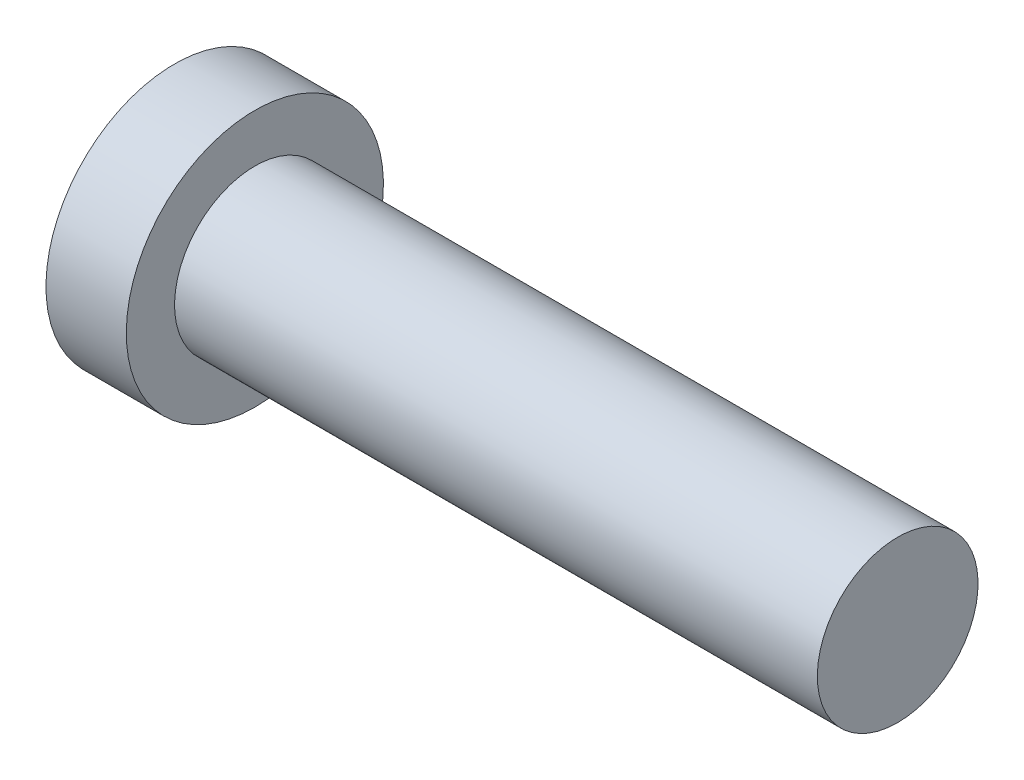
from build123d import *


with BuildPart() as part:
    # Sketch1 → Revolve1 (revolve)
    with BuildSketch(Plane.XY, mode=Mode.PRIVATE) as revolve1_sk:
        Polygon((0, 0), (0, 0.25), (-2, 0.25), (-2, 0.4), (-2.25, 0.4), (-2.25, 0), align=None)
    revolve(revolve1_sk.sketch.rotate(Axis((-2.25, 0, 0), (1, 0, 0)), 180), axis=Axis((-2.25, 0, 0), (1, 0, 0)))


solid = part.part
